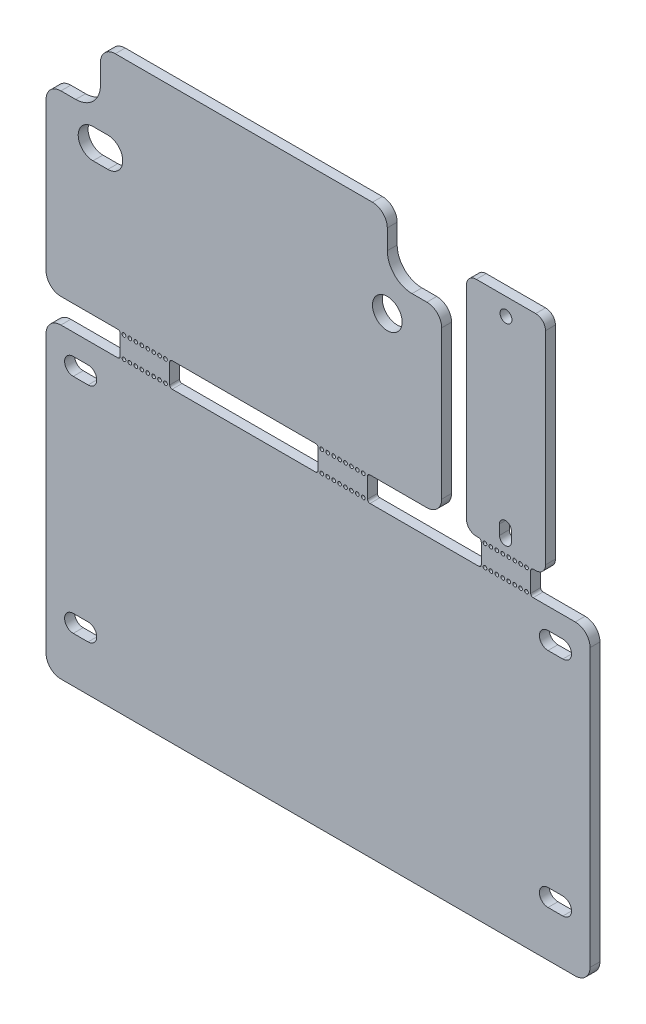
from build123d import *

# Parameters (mm, degrees)
SKETCH_1_W          = 110
SKETCH_1_H          = 65
EXTRUDE_1_DEPTH     = 2
FILLET_1_R          = 3
SKETCH_2_R          = 3
EXTRUDE_2_DEPTH     = 2
FILLET_5_R          = 3
FILLET_6_R          = 5
SKETCH_4_W          = 10
SKETCH_4_H          = 5
EXTRUDE_4_DEPTH     = 2
FILLET_7_R          = 0.5
SKETCH_5_W          = 16
SKETCH_5_H          = 45
SKETCH_5_R          = 1.2
EXTRUDE_5_DEPTH     = 2
SKETCH_6_W          = 10
SKETCH_6_H          = 5
SKETCH_6_W_2        = 5
SKETCH_6_H_2        = 10
EXTRUDE_6_DEPTH     = 2
FILLET_8_R          = 0.5
FILLET_9_R          = 2
SKETCH_7_W          = 110
SKETCH_7_H          = 3
CUT_EXTRUDE_1_DEPTH = 10
FILLET_10_R         = 3
SKETCH_10_W         = 5
SKETCH_10_H         = 19.84178834
CUT_EXTRUDE_3_DEPTH = 10
SKETCH_11_R         = 0.375
CUT_EXTRUDE_4_DEPTH = 10


with BuildPart() as part:
    # ｽｹｯﾁ1 → ﾎﾞｽ - 押し出し1 (new body)
    with BuildSketch(Plane.XY):
        Rectangle(SKETCH_1_W, SKETCH_1_H)
        with BuildLine():
            Line((-49.5, 24.75), (-46.5, 24.75))
            ThreePointArc((-46.5, 24.75), (-44.75, 26.5), (-46.5, 28.25))
            Line((-46.5, 28.25), (-49.5, 28.25))
            ThreePointArc((-49.5, 28.25), (-51.25, 26.5), (-49.5, 24.75))
        make_face(mode=Mode.SUBTRACT)
        with BuildLine():
            Line((-46.5, -20.25), (-49.5, -20.25))
            ThreePointArc((-49.5, -20.25), (-51.25, -18.5), (-49.5, -16.75))
            Line((-49.5, -16.75), (-46.5, -16.75))
            ThreePointArc((-46.5, -16.75), (-44.75, -18.5), (-46.5, -20.25))
        make_face(mode=Mode.SUBTRACT)
        with BuildLine():
            Line((46.5, -20.25), (49.5, -20.25))
            ThreePointArc((49.5, -20.25), (51.25, -18.5), (49.5, -16.75))
            Line((49.5, -16.75), (46.5, -16.75))
            ThreePointArc((46.5, -16.75), (44.75, -18.5), (46.5, -20.25))
        make_face(mode=Mode.SUBTRACT)
        with BuildLine():
            Line((46.5, 28.25), (49.5, 28.25))
            ThreePointArc((49.5, 28.25), (51.25, 26.5), (49.5, 24.75))
            Line((49.5, 24.75), (46.5, 24.75))
            ThreePointArc((46.5, 24.75), (44.75, 26.5), (46.5, 28.25))
        make_face(mode=Mode.SUBTRACT)
    extrude(amount=EXTRUDE_1_DEPTH)

    # ﾌｨﾚｯﾄ1
    fillet_1_edges = [part.edges().sort_by_distance(p)[0] for p in [
        (-55, 32.5, 1),
        (55, 32.5, 1),
    ]]
    fillet(fillet_1_edges, radius=FILLET_1_R)



with BuildPart() as body_2:
    # ｽｹｯﾁ2 → ﾎﾞｽ - 押し出し2 (new body)
    with BuildSketch(Plane.XY.offset(2)):
        Polygon((-55, 37.5), (25, 37.5), (25, 73.5), (14, 73.5), (14, 85.5), (-44, 85.5), (-44, 73.5), (-55, 73.5), align=None)
        with Locations((14, 67.5)):
            Circle(SKETCH_2_R, mode=Mode.SUBTRACT)
        with BuildLine():
            Line((-45.5, 64.5), (-42.5, 64.5))
            ThreePointArc((-42.5, 64.5), (-39.5, 67.5), (-42.5, 70.5))
            Line((-42.5, 70.5), (-45.5, 70.5))
            ThreePointArc((-45.5, 70.5), (-48.5, 67.5), (-45.5, 64.5))
        make_face(mode=Mode.SUBTRACT)
    extrude(amount=-EXTRUDE_2_DEPTH)

    # ﾌｨﾚｯﾄ5
    fillet_5_edges = [body_2.edges().sort_by_distance(p)[0] for p in [
        (25, 37.5, 1),
        (-55, 37.5, 1),
        (-55, 73.5, 1),
        (-44, 85.5, 1),
        (14, 85.5, 1),
        (25, 73.5, 1),
    ]]
    fillet(fillet_5_edges, radius=FILLET_5_R)

    # ﾌｨﾚｯﾄ6
    fillet_6_edges = [body_2.edges().sort_by_distance(p)[0] for p in [
        (-44, 73.5, 1),
        (14, 73.5, 1),
    ]]
    fillet(fillet_6_edges, radius=FILLET_6_R)


with BuildPart() as part_1:
    add(part.part)

    add(body_2.part)  # ﾎﾞｽ - 押し出し4 merges body 2
    # ｽｹｯﾁ4 → ﾎﾞｽ - 押し出し4 (add)
    with BuildSketch(Plane.XY.offset(2)):
        with Locations((-35, 35)):
            Rectangle(SKETCH_4_W, SKETCH_4_H)
        with Locations((5, 35)):
            Rectangle(SKETCH_4_W, SKETCH_4_H)
    extrude(amount=-EXTRUDE_4_DEPTH)

    # ﾌｨﾚｯﾄ7
    fillet_7_edges = [part_1.edges().sort_by_distance(p)[0] for p in [
        (0, 37.5, 1),
        (10, 37.5, 1),
        (10, 32.5, 1),
        (0, 32.5, 1),
        (-40, 37.5, 1),
        (-30, 37.5, 1),
        (-30, 32.5, 1),
        (-40, 32.5, 1),
    ]]
    fillet(fillet_7_edges, radius=FILLET_7_R)



with BuildPart() as body_2_2:
    # ｽｹｯﾁ5 → ﾎﾞｽ - 押し出し5 (new body)
    with BuildSketch(Plane.XY.offset(2)):
        with Locations((38, 60)):
            Rectangle(SKETCH_5_W, SKETCH_5_H)
        with Locations((38, 79)):
            Circle(SKETCH_5_R, mode=Mode.SUBTRACT)
        with BuildLine():
            Line((36.683223365, 42), (36.683223365, 40))
            ThreePointArc((36.683223365, 40), (37.883223365, 38.8), (39.083223365, 40))
            Line((39.083223365, 40), (39.083223365, 42))
            ThreePointArc((39.083223365, 42), (37.883223365, 43.2), (36.683223365, 42))
        make_face(mode=Mode.SUBTRACT)
    extrude(amount=-EXTRUDE_5_DEPTH)


with BuildPart() as part_2:
    add(part_1.part)

    add(body_2_2.part)  # ﾎﾞｽ - 押し出し6 merges body 2 2
    # ｽｹｯﾁ6 → ﾎﾞｽ - 押し出し6 (add)
    with BuildSketch(Plane.XY.offset(2)):
        with Locations((38, 35)):
            Rectangle(SKETCH_6_W, SKETCH_6_H)
        with Locations((27.5, 60.5)):
            Rectangle(SKETCH_6_W_2, SKETCH_6_H_2)
    extrude(amount=-EXTRUDE_6_DEPTH)

    # ﾌｨﾚｯﾄ8
    fillet_8_edges = [part_2.edges().sort_by_distance(p)[0] for p in [
        (33, 37.5, 1),
        (43, 37.5, 1),
        (43, 32.5, 1),
        (33, 32.5, 1),
        (25, 55.5, 1),
        (25, 65.5, 1),
        (30, 65.5, 1),
        (30, 55.5, 1),
    ]]
    fillet(fillet_8_edges, radius=FILLET_8_R)

    # ﾌｨﾚｯﾄ9
    fillet_9_edges = [part_2.edges().sort_by_distance(p)[0] for p in [
        (46, 37.5, 1),
        (46, 82.5, 1),
        (30, 37.5, 1),
        (30, 82.5, 1),
    ]]
    fillet(fillet_9_edges, radius=FILLET_9_R)

    # ｽｹｯﾁ7 → ｶｯﾄ - 押し出し1 (cut)
    with BuildSketch(Plane.XY.offset(2)):
        with Locations((0, -31)):
            Rectangle(SKETCH_7_W, SKETCH_7_H)
    extrude(amount=-CUT_EXTRUDE_1_DEPTH, mode=Mode.SUBTRACT)

    # ﾌｨﾚｯﾄ10
    fillet_10_edges = [part_2.edges().sort_by_distance(p)[0] for p in [
        (55, -29.5, 1),
        (-55, -29.5, 1),
    ]]
    fillet(fillet_10_edges, radius=FILLET_10_R)

    # ｽｹｯﾁ10 → ｶｯﾄ - 押し出し3 (cut)
    with BuildSketch(Plane.XY.offset(2)):
        with Locations((27.5, 60.5)):
            Rectangle(SKETCH_10_W, SKETCH_10_H)
    extrude(amount=-CUT_EXTRUDE_3_DEPTH, mode=Mode.SUBTRACT)

    # ｽｹｯﾁ11 → ｶｯﾄ - 押し出し4 (cut)
    with BuildSketch(Plane.XY.offset(2)):
        with Locations((-39.25, 37.125)):
            Circle(SKETCH_11_R)
        with Locations((-38.05, 37.125)):
            Circle(SKETCH_11_R)
        with Locations((-36.85, 37.125)):
            Circle(SKETCH_11_R)
        with Locations((-35.65, 37.125)):
            Circle(SKETCH_11_R)
        with Locations((-34.45, 37.125)):
            Circle(SKETCH_11_R)
        with Locations((-33.25, 37.125)):
            Circle(SKETCH_11_R)
        with Locations((-32.05, 37.125)):
            Circle(SKETCH_11_R)
        with Locations((-30.85, 37.125)):
            Circle(SKETCH_11_R)
        with Locations((0.75, 37.125)):
            Circle(SKETCH_11_R)
        with Locations((33.75, 37.125)):
            Circle(SKETCH_11_R)
        with Locations((34.95, 37.125)):
            Circle(SKETCH_11_R)
        with Locations((36.15, 37.125)):
            Circle(SKETCH_11_R)
        with Locations((37.35, 37.125)):
            Circle(SKETCH_11_R)
        with Locations((38.55, 37.125)):
            Circle(SKETCH_11_R)
        with Locations((39.75, 37.125)):
            Circle(SKETCH_11_R)
        with Locations((40.95, 37.125)):
            Circle(SKETCH_11_R)
        with Locations((42.15, 37.125)):
            Circle(SKETCH_11_R)
        with Locations((1.95, 37.125)):
            Circle(SKETCH_11_R)
        with Locations((3.15, 37.125)):
            Circle(SKETCH_11_R)
        with Locations((4.35, 37.125)):
            Circle(SKETCH_11_R)
        with Locations((5.55, 37.125)):
            Circle(SKETCH_11_R)
        with Locations((6.75, 37.125)):
            Circle(SKETCH_11_R)
        with Locations((7.95, 37.125)):
            Circle(SKETCH_11_R)
        with Locations((9.15, 37.125)):
            Circle(SKETCH_11_R)
        with Locations(Location((42.15, 32.875, 0), (0, 0, 180))):
            Circle(SKETCH_11_R)
        with Locations(Location((40.95, 32.875, 0), (0, 0, 180))):
            Circle(SKETCH_11_R)
        with Locations(Location((39.75, 32.875, 0), (0, 0, 180))):
            Circle(SKETCH_11_R)
        with Locations(Location((38.55, 32.875, 0), (0, 0, 180))):
            Circle(SKETCH_11_R)
        with Locations(Location((37.35, 32.875, 0), (0, 0, 180))):
            Circle(SKETCH_11_R)
        with Locations(Location((36.15, 32.875, 0), (0, 0, 180))):
            Circle(SKETCH_11_R)
        with Locations(Location((34.95, 32.875, 0), (0, 0, 180))):
            Circle(SKETCH_11_R)
        with Locations(Location((33.75, 32.875, 0), (0, 0, 180))):
            Circle(SKETCH_11_R)
        with Locations(Location((0.75, 32.875, 0), (0, 0, 180))):
            Circle(SKETCH_11_R)
        with Locations(Location((1.95, 32.875, 0), (0, 0, 180))):
            Circle(SKETCH_11_R)
        with Locations(Location((3.15, 32.875, 0), (0, 0, 180))):
            Circle(SKETCH_11_R)
        with Locations(Location((4.35, 32.875, 0), (0, 0, 180))):
            Circle(SKETCH_11_R)
        with Locations(Location((5.55, 32.875, 0), (0, 0, 180))):
            Circle(SKETCH_11_R)
        with Locations(Location((6.75, 32.875, 0), (0, 0, 180))):
            Circle(SKETCH_11_R)
        with Locations(Location((7.95, 32.875, 0), (0, 0, 180))):
            Circle(SKETCH_11_R)
        with Locations(Location((9.15, 32.875, 0), (0, 0, 180))):
            Circle(SKETCH_11_R)
        with Locations(Location((-30.85, 32.875, 0), (0, 0, 180))):
            Circle(SKETCH_11_R)
        with Locations(Location((-32.05, 32.875, 0), (0, 0, 180))):
            Circle(SKETCH_11_R)
        with Locations(Location((-33.25, 32.875, 0), (0, 0, 180))):
            Circle(SKETCH_11_R)
        with Locations(Location((-34.45, 32.875, 0), (0, 0, 180))):
            Circle(SKETCH_11_R)
        with Locations(Location((-35.65, 32.875, 0), (0, 0, 180))):
            Circle(SKETCH_11_R)
        with Locations(Location((-36.85, 32.875, 0), (0, 0, 180))):
            Circle(SKETCH_11_R)
        with Locations(Location((-38.05, 32.875, 0), (0, 0, 180))):
            Circle(SKETCH_11_R)
        with Locations(Location((-39.25, 32.875, 0), (0, 0, 180))):
            Circle(SKETCH_11_R)
    extrude(amount=-CUT_EXTRUDE_4_DEPTH, mode=Mode.SUBTRACT)


solid = part_2.part
